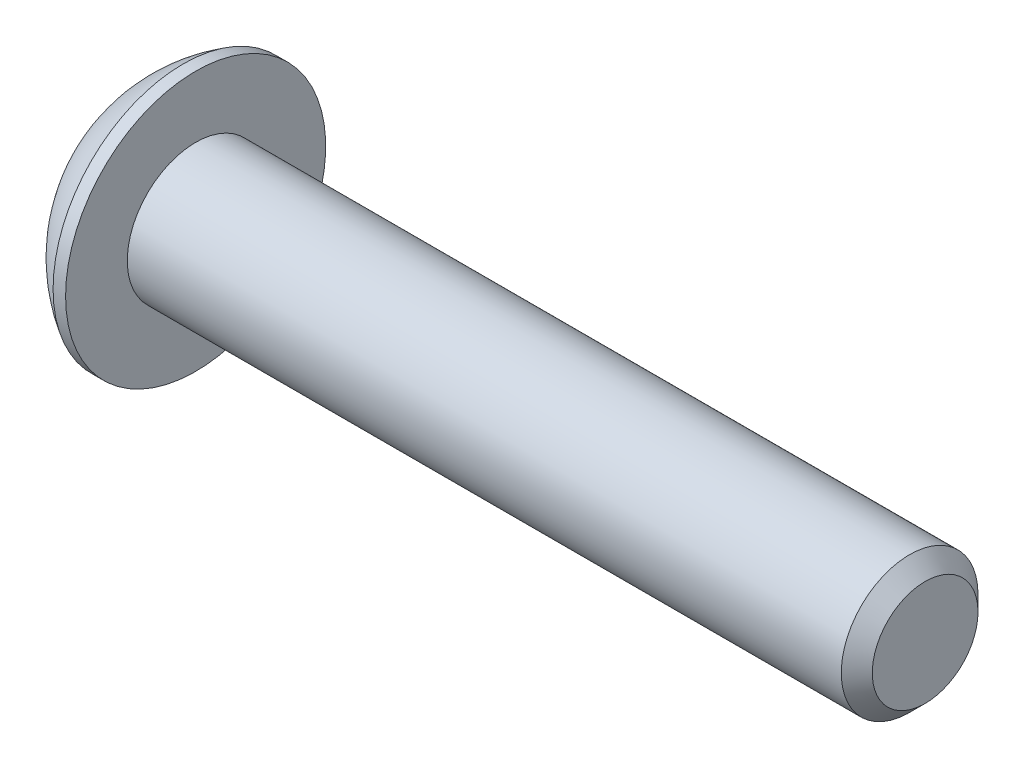
from build123d import *

# Parameters (mm, degrees)
SKETCH2_R           = 2.0828
BOSS_EXTRUDE1_DEPTH = 22.225
CUT_EXTRUDE1_DEPTH  = 1.3208
CHAMFER1_SIZE       = 0.47244


with BuildPart() as part:
    # Sketch1 → Revolve1 (revolve)
    with BuildSketch(Plane(origin=(0, 0, 0), x_dir=(-1, 0, 0), z_dir=(0, 0, -1)), mode=Mode.PRIVATE) as revolve1_sk:
        with BuildLine():
            Line((-2.2098, 3.9624), (-2.2098, 0))
            Line((-2.2098, 0), (0, 0))
            Line((0, 0), (0, 1.9812))
            ThreePointArc((0, 1.9812), (-0.765445829, 3.109296158), (-1.8288, 3.9624))
            Line((-1.8288, 3.9624), (-2.2098, 3.9624))
        make_face()
    revolve(revolve1_sk.sketch.rotate(Axis((2.2098, 0, 0), (-1, 0, 0)), 270), axis=Axis((2.2098, 0, 0), (-1, 0, 0)))

    # Sketch2 → Boss-Extrude1 (add)
    with BuildSketch(Plane(origin=(2.2098, 0, 0), x_dir=(0, 0, -1), z_dir=(1, 0, 0))):
        Circle(SKETCH2_R)
    extrude(amount=BOSS_EXTRUDE1_DEPTH)

    # Sketch3 → Cut-Extrude1 (cut)
    with BuildSketch(Plane.ZY):
        Polygon((1.1938, 0.689240751), (0, 1.378481503), (-1.1938, 0.689240751), (-1.1938, -0.689240751), (0, -1.378481503), (1.1938, -0.689240751), align=None)
    extrude(amount=-CUT_EXTRUDE1_DEPTH, mode=Mode.SUBTRACT)

    # Sketch4 → Cut-Revolve1 (revolve, cut)
    with BuildSketch(Plane.XY):
        Polygon((1.3208, 1.1938), (1.3208, 0), (2.010040752, 0), align=None)
    revolve(axis=Axis((1.320775, 0, 0), (1, 0, 0)), mode=Mode.SUBTRACT)

    # Chamfer1
    chamfer1_edges = [part.edges().sort_by_distance(p)[0] for p in [
        (24.4348, 0, 2.0828),
    ]]
    chamfer(chamfer1_edges, length=CHAMFER1_SIZE)


solid = part.part
